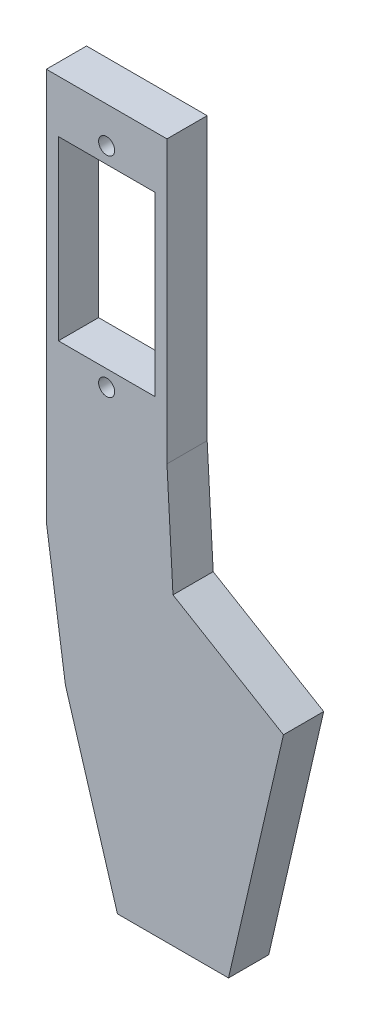
from build123d import *

# Parameters (mm, degrees)
SKETCH1_W           = 15
SKETCH1_H           = 35
BOSS_EXTRUDE1_DEPTH = 5
SKETCH2_R           = 1
SKETCH2_W           = 12
SKETCH2_H           = 22
CUT_EXTRUDE1_DEPTH  = 5
BOSS_EXTRUDE2_DEPTH = 5


with BuildPart() as part:
    # Sketch1 → Boss-Extrude1 (new body)
    with BuildSketch(Plane.XY):
        with Locations((-15.154109589, 0.428082192)):
            Rectangle(SKETCH1_W, SKETCH1_H)
    extrude(amount=BOSS_EXTRUDE1_DEPTH)

    # Sketch2 → Cut-Extrude1 (cut)
    with BuildSketch(Plane.XY.offset(5)):
        with Locations((-15.154109589, -12.571917808)):
            Circle(SKETCH2_R)
        with Locations((-15.154109589, 13.428082192)):
            Circle(SKETCH2_R)
        with Locations((-15.154109589, 0.428082192)):
            Rectangle(SKETCH2_W, SKETCH2_H)
    extrude(amount=-CUT_EXTRUDE1_DEPTH, mode=Mode.SUBTRACT)

    # Sketch3 → Boss-Extrude2 (add)
    with BuildSketch(Plane.XY.offset(5)):
        Polygon((-22.654109589, -17.071917808), (-22.654109589, -30.804233772), (-20.282646179, -47.190952111), (-17.359431797, -56.865022466), (-13.811210888, -68.607486145), (0, -68.607486145), (6.832413717, -38.997592941), (-6.905605444, -30.804233772), (-7.654109589, -17.071917808), align=None)
    extrude(amount=-BOSS_EXTRUDE2_DEPTH)


solid = part.part
